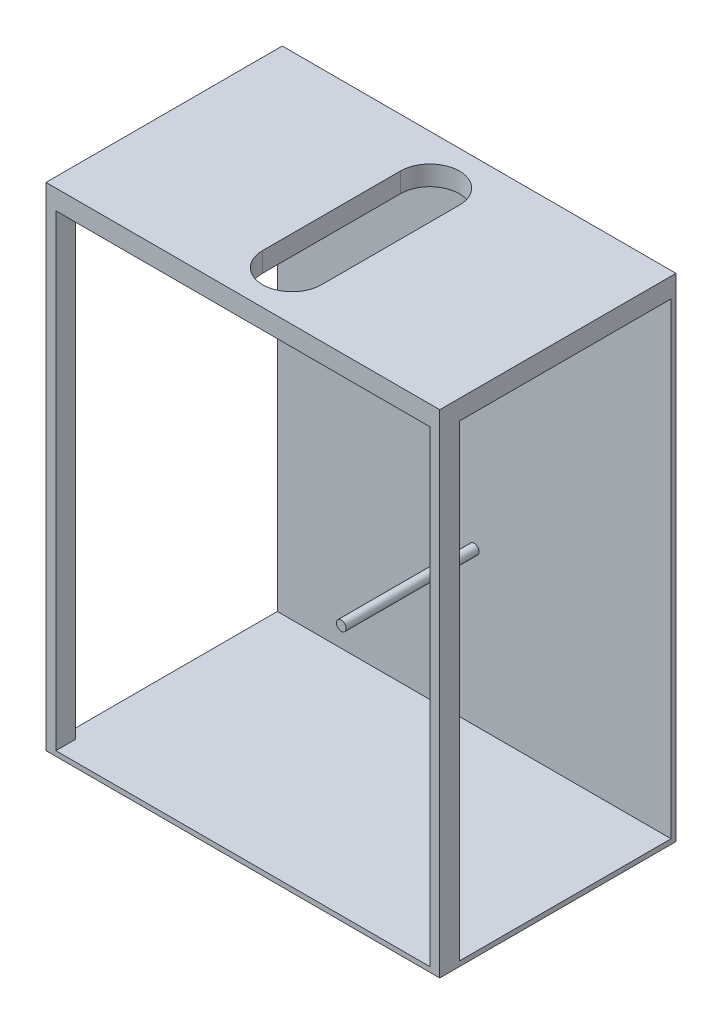
from build123d import *

# Parameters (mm, degrees)
SKETCH1_W           = 508
SKETCH1_H           = 635
BOSS_EXTRUDE1_DEPTH = 6.35
SKETCH2_R           = 6.35
BOSS_EXTRUDE2_DEPTH = 177.8
SKETCH3_W           = 508
SKETCH3_H           = 298.45
BOSS_EXTRUDE3_DEPTH = 6.35
BOSS_EXTRUDE4_DEPTH = 12.7
SKETCH6_W           = 298.45
SKETCH6_H           = 25.4
BOSS_EXTRUDE6_DEPTH = 482.6
CUT_EXTRUDE1_DEPTH  = 25.4


with BuildPart() as part:
    # Sketch1 → Boss-Extrude1 (new body)
    with BuildSketch(Plane.XY):
        with Locations((254, 317.5)):
            Rectangle(SKETCH1_W, SKETCH1_H)
    extrude(amount=BOSS_EXTRUDE1_DEPTH)

    # Sketch2 → Boss-Extrude2 (add)
    with BuildSketch(Plane.XY):
        with Locations(Location((254, 203.2, 0), (0, 0, 180))):
            Circle(SKETCH2_R)
    extrude(amount=BOSS_EXTRUDE2_DEPTH)

    # Sketch3 → Boss-Extrude3 (add)
    with BuildSketch(Plane(origin=(0, 0, 0), x_dir=(1, 0, 0), z_dir=(0, 1, 0))):
        with Locations((254, -155.575)):
            Rectangle(SKETCH3_W, SKETCH3_H)
    extrude(amount=BOSS_EXTRUDE3_DEPTH)

    # Sketch4 → Boss-Extrude4 (add)
    with BuildSketch(Plane(origin=(0, 0, 0), x_dir=(0, 0, -1), z_dir=(1, 0, 0))):
        Polygon((-304.8, 6.35), (-304.8, 635), (-6.35, 635), (-6.35, 609.6), (-279.4, 609.6), (-279.4, 6.35), align=None)
    boss_extrude4 = extrude(amount=BOSS_EXTRUDE4_DEPTH)

    # Mirror1: Boss-Extrude4 across plane
    add(boss_extrude4.mirror(Plane(origin=(254, 0, 0), x_dir=(0, 0, 1), z_dir=(1, 0, 0))))

    # Sketch6 → Boss-Extrude6 (add)
    with BuildSketch(Plane(origin=(12.7, 0, 0), x_dir=(0, 0, -1), z_dir=(1, 0, 0))):
        with Locations((-155.575, 622.3)):
            Rectangle(SKETCH6_W, SKETCH6_H)
    extrude(amount=BOSS_EXTRUDE6_DEPTH)

    # Sketch7 → Cut-Extrude1 (cut)
    with BuildSketch(Plane(origin=(0, 635, 0), x_dir=(1, 0, 0), z_dir=(0, 1, 0))):
        with BuildLine():
            Line((292.1, -63.5), (292.1, -241.3))
            ThreePointArc((292.1, -241.3), (254, -279.4), (215.9, -241.3))
            Line((215.9, -241.3), (215.9, -63.5))
            ThreePointArc((215.9, -63.5), (254, -25.4), (292.1, -63.5))
        make_face()
    extrude(amount=-CUT_EXTRUDE1_DEPTH, mode=Mode.SUBTRACT)


solid = part.part
